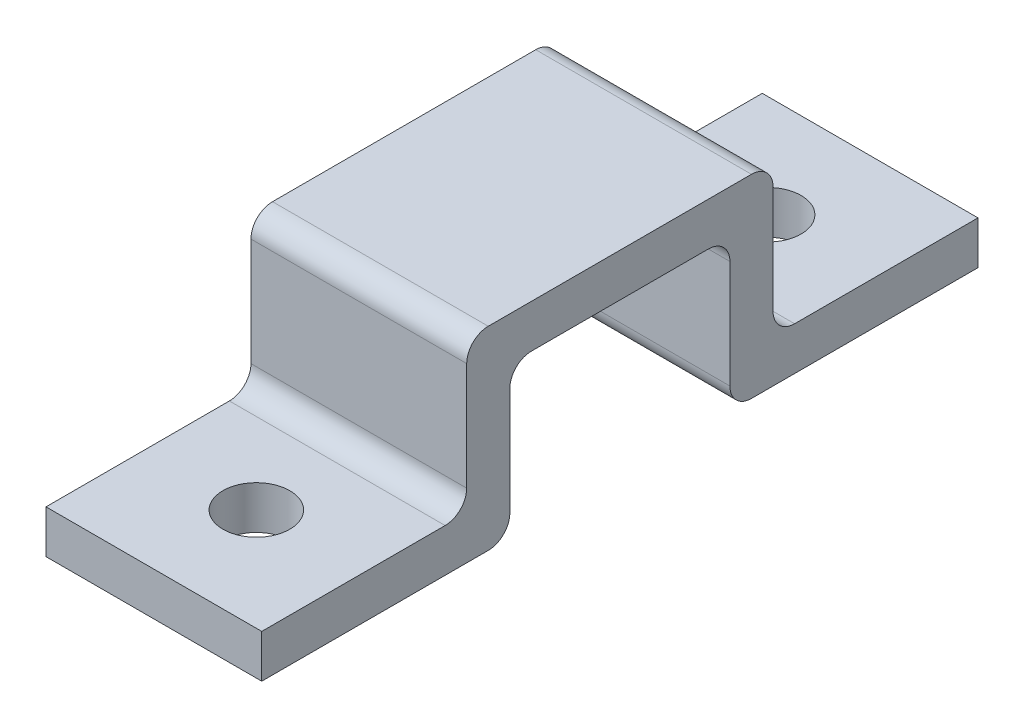
from build123d import *

# Parameters (mm, degrees)
BOSS_EXTRUDE1_DEPTH = 20
SKETCH2_R           = 3.1
CUT_EXTRUDE1_DEPTH  = 4
FILLET1_R           = 2


with BuildPart() as part:
    # Sketch1 → Boss-Extrude1 (new body)
    with BuildSketch(Plane(origin=(0, 0, 0), x_dir=(0, 0, -1), z_dir=(1, 0, 0))):
        Polygon((-10.2, 0), (10.2, 0), (10.2, -14), (33.2, -14), (33.2, -10), (14.2, -10), (14.2, 4), (-14.2, 4), (-14.2, -10), (-33.2, -10), (-33.2, -14), (-10.2, -14), align=None)
    extrude(amount=BOSS_EXTRUDE1_DEPTH)

    # Sketch2 → Cut-Extrude1 (cut)
    with BuildSketch(Plane(origin=(0, -10, 0), x_dir=(1, 0, 0), z_dir=(0, 1, 0))):
        with Locations(Location((10, 23.7, 0), (0, 0, 270))):
            Circle(SKETCH2_R)
    cut_extrude1 = extrude(amount=-CUT_EXTRUDE1_DEPTH, mode=Mode.SUBTRACT)

    # Mirror1: Cut-Extrude1 across plane
    add(cut_extrude1.mirror(Plane.XY), mode=Mode.SUBTRACT)

    # Fillet1
    fillet1_edges = [part.edges().sort_by_distance(p)[0] for p in [
        (10, -14, 10.2),
        (10, -10, 14.2),
        (10, 4, 14.2),
        (10, 4, -14.2),
        (10, -10, -14.2),
        (10, -14, -10.2),
        (10, 0, -10.2),
        (10, 0, 10.2),
    ]]
    fillet(fillet1_edges, radius=FILLET1_R)


solid = part.part
